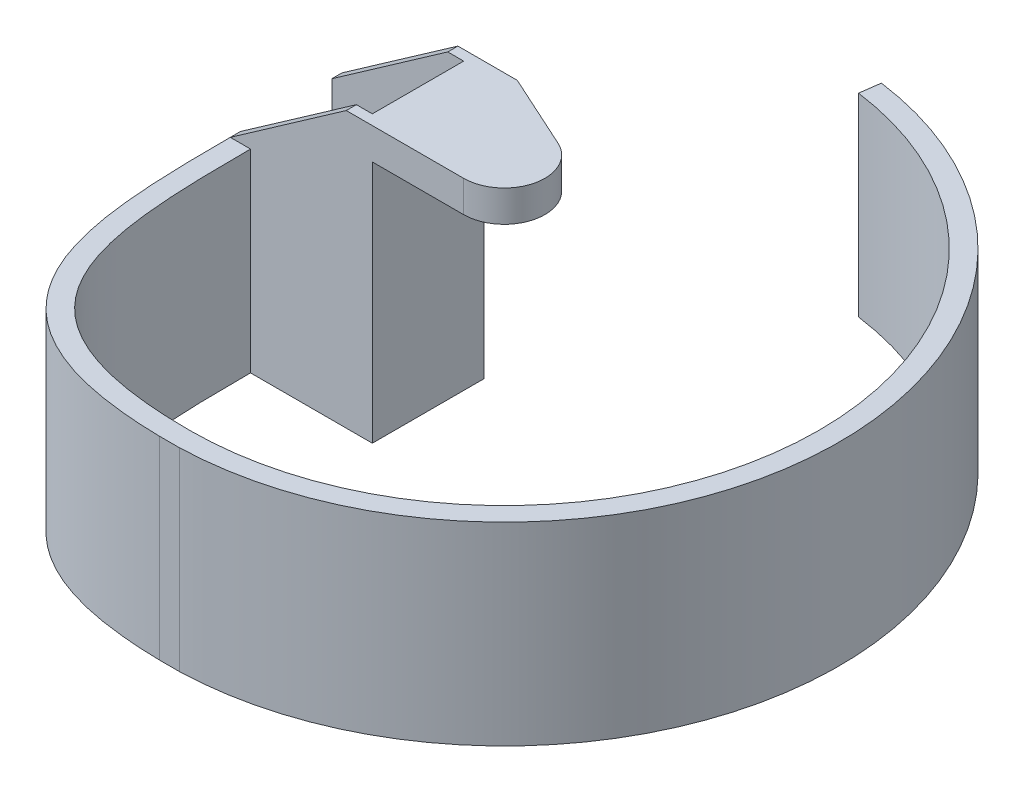
from build123d import *

# Parameters (mm, degrees)
BASE_EXTRUDE_DEPTH           = 121.285
SKETCH3_4_W                  = 12.658404279
SKETCH3_4_H                  = 69.85
MOTOR_BOX_CORE_SUPPORT_DEPTH = 172.085
WHEEL_SPACE_REACH            = 359.533
SKETCH4_W                    = 82.55
SKETCH4_H                    = 152.4
SKETCH5_W                    = 82.508404279
SKETCH5_H                    = 57.15
MOTOR_SPACE_DEPTH            = 121.285
MOTOR_SPACE_RIBS_DEPTH       = 358.532752856


with BuildPart() as part:
    # Sketch3 → Base extrude (new body)
    with BuildSketch(Plane(origin=(0, 0, 0), x_dir=(1, 0, 0), z_dir=(0, 1, 0))):
        with BuildLine():
            Line((26.55331123, 195.050875832), (28.266428083, 207.634803305))
            ThreePointArc((28.266428083, 207.634803305), (209.260756715, -11.006279992), (6.329202139, -209.454395276))
            Line((6.329202139, -209.454395276), (-6.329202139, -209.454395276))
            add(Edge.make_bspline(
                [(-146.008404279, -25.4), (-146.008404279, -25.825184703), (-146.008186701, -28.390264622), (-145.992828986, -37.675812079), (-145.847861717, -52.813230692), (-145.252148771, -71.571281929), (-144.048815033, -89.419368639), (-142.031880927, -106.362231784), (-137.954990072, -127.728726744), (-131.289734266, -147.26224301), (-120.928636207, -164.576629863), (-111.101066218, -176.207339111), (-99.137557526, -186.230706711), (-85.06323068, -194.472251254), (-71.591092365, -199.823977742), (-59.732617944, -203.218129468), (-50.280608969, -205.32790847), (-40.250071446, -207.008611147), (-31.389652459, -208.056286946), (-23.987147203, -208.684629614), (-18.276024056, -209.051283621), (-13.377371895, -209.269931643), (-9.381928102, -209.392630987), (-7.343469775, -209.4368391), (-6.329202139, -209.454395276)],
                knots=[0, 0, 0, 0, 0.003998364, 0.024104834, 0.088078657, 0.152052481, 0.216026304, 0.280000128, 0.343973951, 0.471921599, 0.535895422, 0.599869246, 0.663843069, 0.727816893, 0.791790716, 0.823777628, 0.85576454, 0.887751452, 0.919738363, 0.935731819, 0.951725275, 0.967718731, 0.975715459, 0.983712187, 0.983712187, 0.983712187, 0.983712187], degree=3))
            Line((-146.008404279, -25.4), (-133.35, -25.4))
            add(Edge.make_bspline(
                [(-133.35, -25.4), (-133.35, -131.233333333), (-127, -196.85), (0, -196.85)],
                knots=[0, 0, 0, 0, 1, 1, 1, 1], degree=3))
            ThreePointArc((0, -196.85), (196.39970393, -13.307095711), (26.55331123, 195.050875832))
        make_face()
    extrude(amount=BASE_EXTRUDE_DEPTH)

    # Sketch3<4> → Motor box & Core support (add)
    with BuildSketch(Plane(origin=(0, 0, 0), x_dir=(1, 0, 0), z_dir=(0, 1, 0))):
        with Locations((-139.67920214, 9.525)):
            Rectangle(SKETCH3_4_W, SKETCH3_4_H)
        with BuildLine():
            Line((-133.35, 44.45), (-133.35, -25.4))
            Line((-133.35, -25.4), (0, -25.4))
            ThreePointArc((0, -25.4), (24.821670104, -5.389312873), (10.533208363, 23.11301628))
            Line((10.533208363, 23.11301628), (-36.286529277, 44.45))
            Line((-36.286529277, 44.45), (-133.35, 44.45))
        make_face()
    extrude(amount=MOTOR_BOX_CORE_SUPPORT_DEPTH)

    # Sketch4 → Wheel space (cut, up to next)
    with BuildSketch(Plane.XY.offset(25.4), mode=Mode.PRIVATE) as wheel_space_sk1:
        with Locations((-15.875, 76.2)):
            Rectangle(SKETCH4_W, SKETCH4_H)
    wheel_space_tool1 = extrude(wheel_space_sk1.sketch, amount=-WHEEL_SPACE_REACH, mode=Mode.PRIVATE) & part.part
    add(wheel_space_tool1.solids().sort_by_distance((-15.875, 76.2, 25.4))[0], mode=Mode.SUBTRACT)

    # Sketch5 → Motor space (cut)
    with BuildSketch(Plane(origin=(0, 172.085, 0), x_dir=(1, 0, 0), z_dir=(0, 1, 0))):
        with Locations((-104.75420214, 9.525)):
            Rectangle(SKETCH5_W, SKETCH5_H)
    extrude(amount=-MOTOR_SPACE_DEPTH, mode=Mode.SUBTRACT)

    # Sketch6 → Motor Space Ribs (cut, through all)
    with BuildSketch(Plane.XY.offset(25.4)):
        Polygon((-146.008404279, 121.285), (-73.458485536, 172.085), (-146.008404279, 172.085), align=None)
    extrude(amount=-MOTOR_SPACE_RIBS_DEPTH, mode=Mode.SUBTRACT)


solid = part.part
